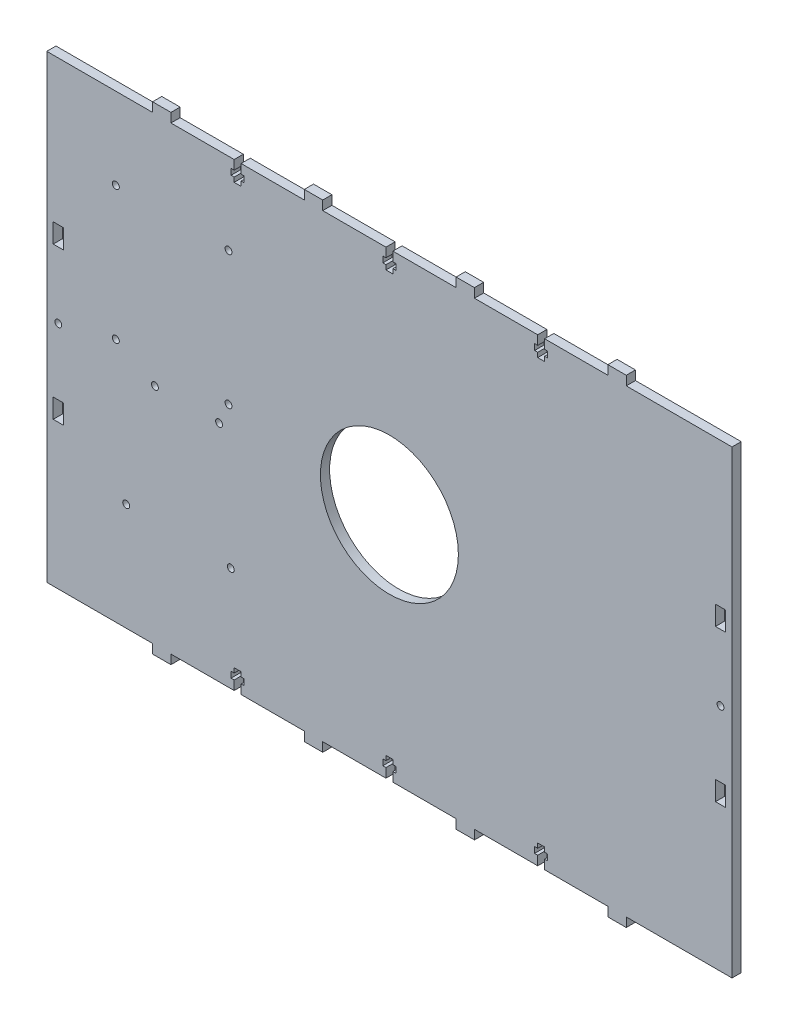
from build123d import *

# Parameters (mm, degrees)
SKETCH_1_R          = 1.5
SKETCH_1_R_2        = 30
SKETCH_1_W          = 4.4
SKETCH_1_H          = 8.4
EXTRUDE_1_DEPTH     = 4
SKETCH_4_R          = 1.5
CUT_EXTRUDE_1_DEPTH = 10


with BuildPart() as part:
    # 草图1 → 凸台-拉伸1 (new body)
    with BuildSketch(Plane.XY):
        Polygon((0, 0), (0, -4), (-1.35, -4), (-1.35, -6.6), (0, -6.6), (0, -8.6), (3, -8.6), (3, -6.6), (4.35, -6.6), (4.35, -4), (3, -4), (3, 0), (30.5, 0), (30.5, 4), (38.5, 4), (38.5, 0), (66, 0), (66, -4), (64.65, -4), (64.65, -6.6), (66, -6.6), (66, -8.6), (69, -8.6), (69, -6.6), (70.35, -6.6), (70.35, -4), (69, -4), (69, 0), (96.5, 0), (96.5, 4), (104.5, 4), (104.5, 0), (132, 0), (143.5, 0), (145.5, 0), (150.5, 0), (150.5, -200), (145.5, -200), (143.5, -200), (132, -200), (104.5, -200), (104.5, -204), (96.5, -204), (96.5, -200), (69, -200), (69, -196), (70.35, -196), (70.35, -193.4), (69, -193.4), (69, -191.4), (66, -191.4), (66, -193.4), (64.65, -193.4), (64.65, -196), (66, -196), (66, -200), (38.5, -200), (38.5, -204), (30.5, -204), (30.5, -200), (3, -200), (3, -196), (4.35, -196), (4.35, -193.4), (3, -193.4), (3, -191.4), (0, -191.4), (0, -193.4), (-1.35, -193.4), (-1.35, -196), (0, -196), (0, -200), (-27.5, -200), (-27.5, -204), (-35.5, -204), (-35.5, -200), (-63, -200), (-63, -196), (-61.65, -196), (-61.65, -193.4), (-63, -193.4), (-63, -191.4), (-66, -191.4), (-66, -193.4), (-67.35, -193.4), (-67.35, -196), (-66, -196), (-66, -200), (-93.5, -200), (-93.5, -204), (-101.5, -204), (-101.5, -200), (-129, -200), (-140.5, -200), (-142.5, -200), (-147.5, -200), (-147.5, 0), (-142.5, 0), (-140.5, 0), (-129, 0), (-101.5, 0), (-101.5, 4), (-93.5, 4), (-93.5, 0), (-66, 0), (-66, -4), (-67.35, -4), (-67.35, -6.6), (-66, -6.6), (-66, -8.6), (-63, -8.6), (-63, -6.6), (-61.65, -6.6), (-61.65, -4), (-63, -4), (-63, 0), (-35.5, 0), (-35.5, 4), (-27.5, 4), (-27.5, 0), align=None)
        with Locations((-142.5, -100)):
            Circle(SKETCH_1_R, mode=Mode.SUBTRACT)
        with Locations(Location((145.5, -100, 0), (0, 0, 180))):
            Circle(SKETCH_1_R, mode=Mode.SUBTRACT)
        with Locations((1.5, -100)):
            Circle(SKETCH_1_R_2, mode=Mode.SUBTRACT)
        with Locations((-142.5, -67)):
            Rectangle(SKETCH_1_W, SKETCH_1_H, mode=Mode.SUBTRACT)
        with Locations((-142.5, -133)):
            Rectangle(SKETCH_1_W, SKETCH_1_H, mode=Mode.SUBTRACT)
        with Locations((145.5, -133)):
            Rectangle(SKETCH_1_W, SKETCH_1_H, mode=Mode.SUBTRACT)
        with Locations((145.5, -67)):
            Rectangle(SKETCH_1_W, SKETCH_1_H, mode=Mode.SUBTRACT)
    extrude(amount=EXTRUDE_1_DEPTH)

    # 草图4 → 切除-拉伸1 (cut)
    with BuildSketch(Plane.XY.offset(4)):
        with Locations((-100.464854909, -102.524202067)):
            Circle(SKETCH_4_R)
        with Locations((-72.564854909, -102.524202067)):
            Circle(SKETCH_4_R)
        with Locations((-112.964854909, -153.324202067)):
            Circle(SKETCH_4_R)
        with Locations((-67.464854909, -154.624202067)):
            Circle(SKETCH_4_R)
        with Locations((-117.464854909, -35.441983185)):
            Circle(SKETCH_4_R)
        with Locations((-68.464854909, -35.441983185)):
            Circle(SKETCH_4_R)
        with Locations((-117.464854909, -93.441983185)):
            Circle(SKETCH_4_R)
        with Locations((-68.464854909, -93.441983185)):
            Circle(SKETCH_4_R)
    extrude(amount=-CUT_EXTRUDE_1_DEPTH, mode=Mode.SUBTRACT)


solid = part.part
